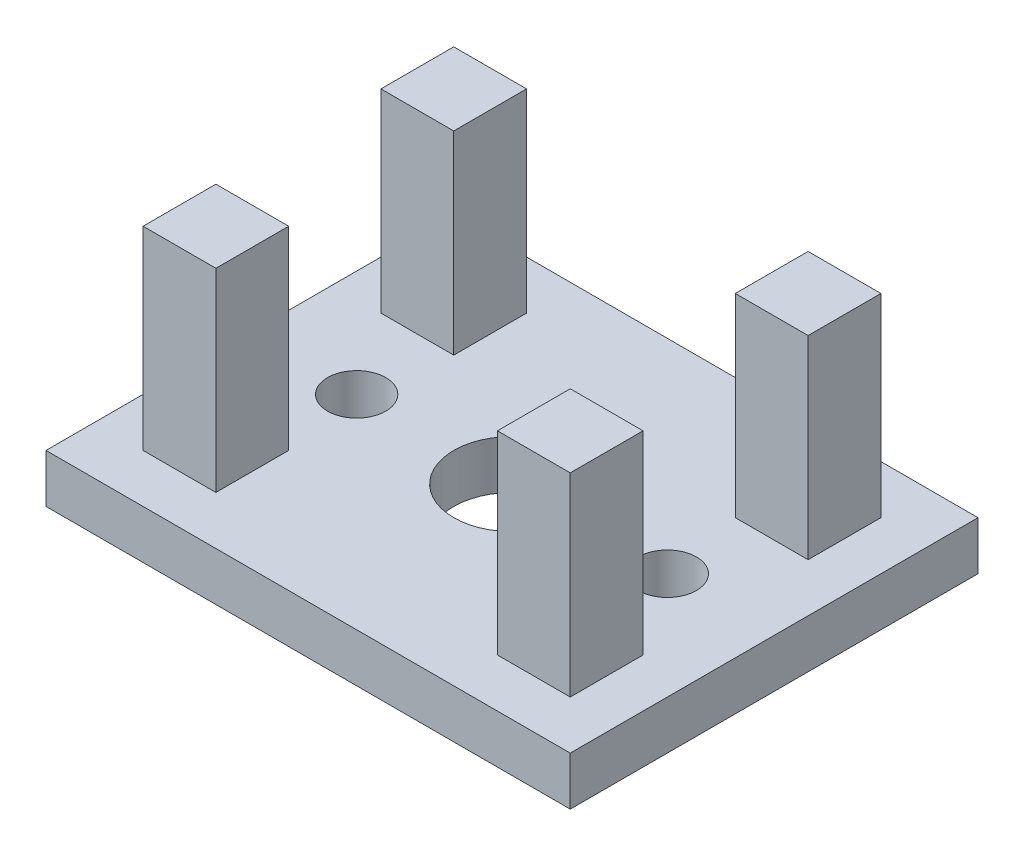
from build123d import *

# Parameters (mm, degrees)
SKETCH4_W           = 54
SKETCH4_H           = 42
BOSS_EXTRUDE1_DEPTH = 5
SKETCH5_R           = 6
SKETCH5_R_2         = 3
CUT_EXTRUDE1_DEPTH  = 5
SKETCH6_W           = 7.5
SKETCH6_H           = 7.5
BOSS_EXTRUDE3_DEPTH = 20


with BuildPart() as part:
    # Sketch4 → Boss-Extrude1 (new body)
    with BuildSketch(Plane(origin=(0, 0, 0), x_dir=(1, 0, 0), z_dir=(0, 1, 0))):
        Rectangle(SKETCH4_W, SKETCH4_H)
    extrude(amount=BOSS_EXTRUDE1_DEPTH)

    # Sketch5 → Cut-Extrude1 (cut)
    with BuildSketch(Plane(origin=(0, 5, 0), x_dir=(1, 0, 0), z_dir=(0, 1, 0))):
        with Locations(Location((0, 0, 0), (0, 0, 270))):
            Circle(SKETCH5_R)
        with Locations(Location((-16, 0, 0), (0, 0, 270))):
            Circle(SKETCH5_R_2)
        with Locations(Location((16, 0, 0), (0, 0, 270))):
            Circle(SKETCH5_R_2)
    extrude(amount=-CUT_EXTRUDE1_DEPTH, mode=Mode.SUBTRACT)

    # Sketch6 → Boss-Extrude3 (add)
    with BuildSketch(Plane(origin=(0, 5, 0), x_dir=(1, 0, 0), z_dir=(0, 1, 0))):
        with Locations((-18.25, 12.25)):
            Rectangle(SKETCH6_W, SKETCH6_H)
        with Locations((18.25, 12.25)):
            Rectangle(SKETCH6_W, SKETCH6_H)
        with Locations((-18.25, -12.25)):
            Rectangle(SKETCH6_W, SKETCH6_H)
        with Locations((18.25, -12.25)):
            Rectangle(SKETCH6_W, SKETCH6_H)
    extrude(amount=BOSS_EXTRUDE3_DEPTH)


solid = part.part
